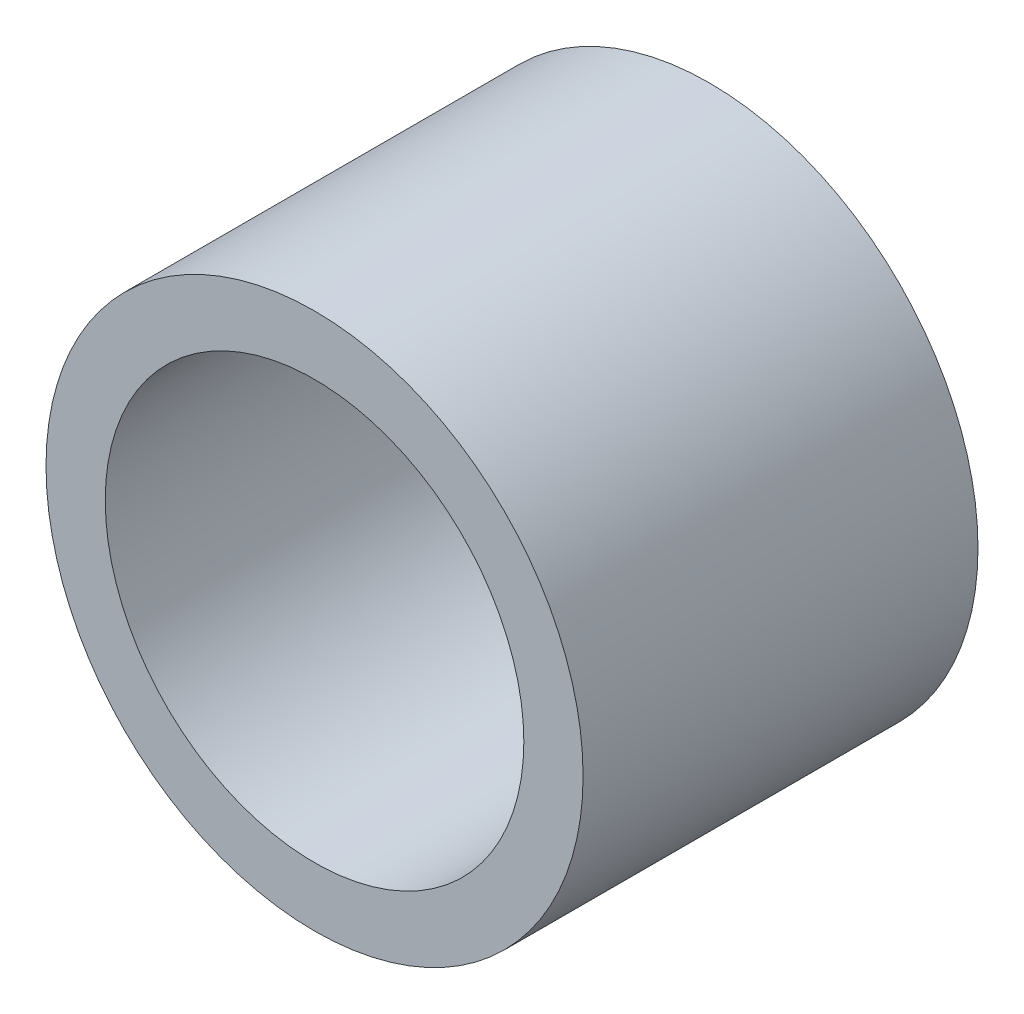
from build123d import *

# Parameters (mm, degrees)
SKETCH_1_R      = 3.4
SKETCH_1_R_2    = 2.65
EXTRUDE_1_DEPTH = 5


with BuildPart() as part:
    # 草图1 → 凸台-拉伸1 (new body)
    with BuildSketch(Plane.XY):
        Circle(SKETCH_1_R)
        Circle(SKETCH_1_R_2, mode=Mode.SUBTRACT)
    extrude(amount=EXTRUDE_1_DEPTH)


solid = part.part
